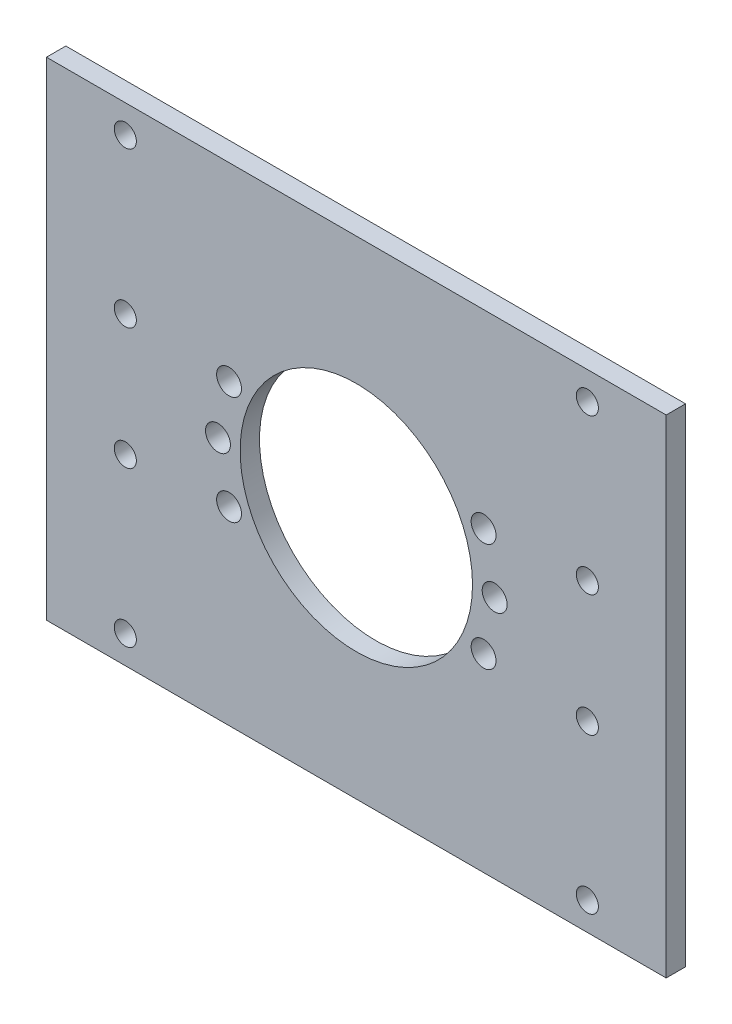
from build123d import *

# Parameters (mm, degrees)
SKETCH1_W           = 112
SKETCH1_H           = 88.12
SKETCH1_R           = 21
SKETCH1_R_2         = 2.25
BOSS_EXTRUDE1_DEPTH = 3.5
SKETCH2_R           = 1.997849158
SKETCH2_R_2         = 1.997849136
SKETCH2_R_3         = 1.997849041
SKETCH2_R_4         = 1.99784915
CUT_EXTRUDE1_DEPTH  = 3.5


with BuildPart() as part:
    # Sketch1 → Boss-Extrude1 (new body)
    with BuildSketch(Plane.XY):
        Rectangle(SKETCH1_W, SKETCH1_H)
        Circle(SKETCH1_R, mode=Mode.SUBTRACT)
        with Locations((25, 0)):
            Circle(SKETCH1_R_2, mode=Mode.SUBTRACT)
        with Locations((23, 9.797958971)):
            Circle(SKETCH1_R_2, mode=Mode.SUBTRACT)
        with Locations((23, -9.797958971)):
            Circle(SKETCH1_R_2, mode=Mode.SUBTRACT)
        with Locations((-23, 9.797958971)):
            Circle(SKETCH1_R_2, mode=Mode.SUBTRACT)
        with Locations((-25, 0)):
            Circle(SKETCH1_R_2, mode=Mode.SUBTRACT)
        with Locations((-23, -9.797958971)):
            Circle(SKETCH1_R_2, mode=Mode.SUBTRACT)
    extrude(amount=BOSS_EXTRUDE1_DEPTH)

    # Sketch2 → Cut-Extrude1 (cut)
    with BuildSketch(Plane.XY.offset(3.5)):
        with Locations((-41.749999967, 11.002177996)):
            Circle(SKETCH2_R)
        with Locations((41.750000033, 38.997821996)):
            Circle(SKETCH2_R)
        with Locations((-41.749999967, 39.002177996)):
            Circle(SKETCH2_R)
        with Locations((41.750000033, 10.997821996)):
            Circle(SKETCH2_R)
        with Locations((41.75, -10.997822003)):
            Circle(SKETCH2_R_2)
        with Locations((41.75, -38.997822003)):
            Circle(SKETCH2_R_2)
        with Locations((-41.749999857, -38.997821959)):
            Circle(SKETCH2_R_3)
        with Locations((-41.749999952, -10.997822035)):
            Circle(SKETCH2_R_4)
    extrude(amount=-CUT_EXTRUDE1_DEPTH, mode=Mode.SUBTRACT)


solid = part.part
